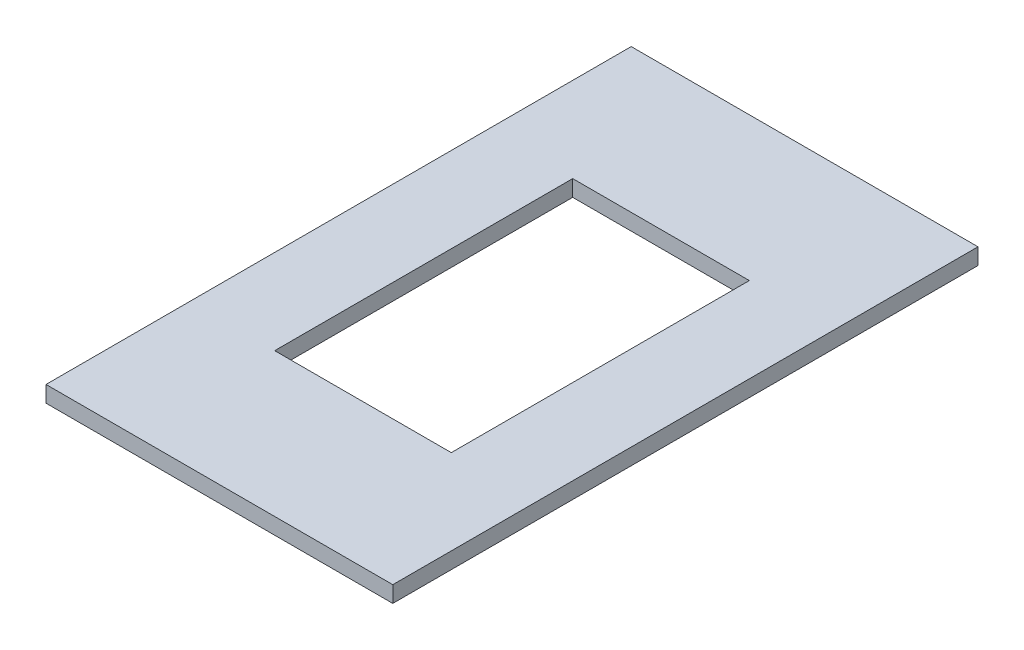
from build123d import *

# Parameters (mm, degrees)
SKETCH1_W           = 213.3333333
SKETCH1_H           = 360
BOSS_EXTRUDE2_DEPTH = 10
SKETCH2_W           = 108.645297868
SKETCH2_H           = 183.338940182
CUT_EXTRUDE1_DEPTH  = 10


with BuildPart() as part:
    # Sketch1 → Boss-Extrude2 (new body)
    with BuildSketch(Plane(origin=(0, 0, 0), x_dir=(1, 0, 0), z_dir=(0, 1, 0))):
        with Locations((106.66666665, -180)):
            Rectangle(SKETCH1_W, SKETCH1_H)
    extrude(amount=BOSS_EXTRUDE2_DEPTH)

    # Sketch2 → Cut-Extrude1 (cut)
    with BuildSketch(Plane(origin=(0, 10, 0), x_dir=(1, 0, 0), z_dir=(0, 1, 0))):
        with Locations((106.66666665, -180)):
            Rectangle(SKETCH2_W, SKETCH2_H)
    extrude(amount=-CUT_EXTRUDE1_DEPTH, mode=Mode.SUBTRACT)


solid = part.part
